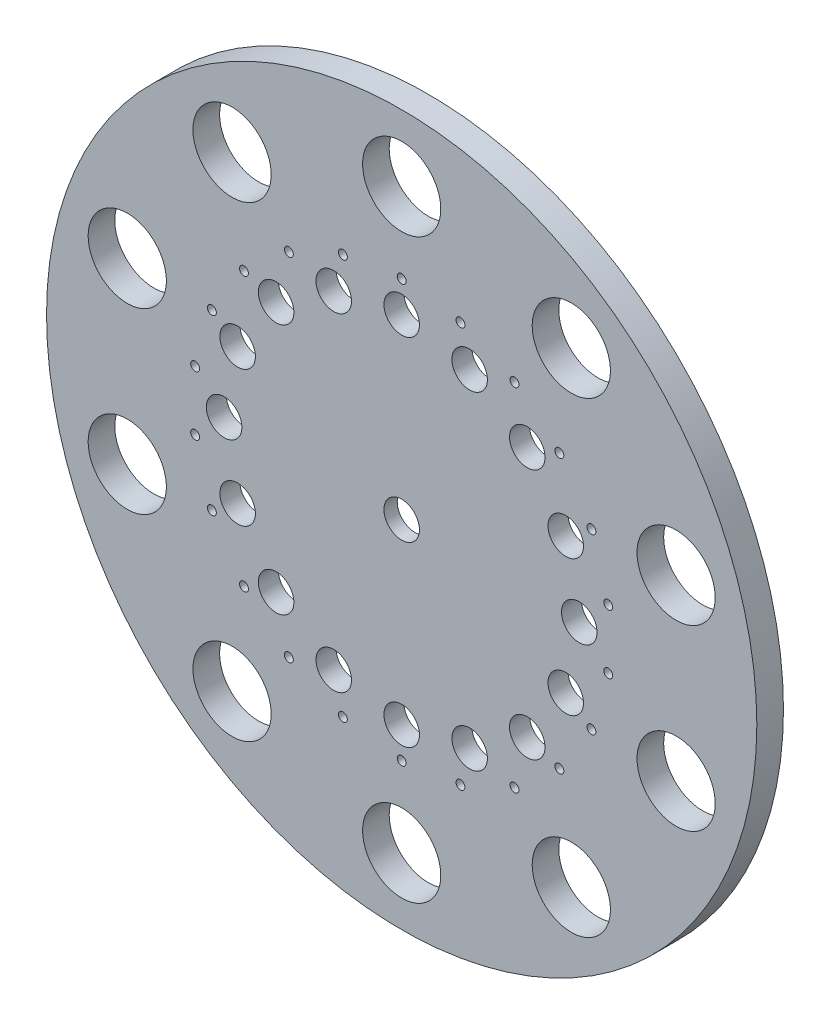
from build123d import *

# Parameters (mm, degrees)
SKETCH1_R           = 80
BOSS_EXTRUDE1_DEPTH = 6
SKETCH2_R           = 20
CUT_EXTRUDE1_DEPTH  = 3
SKETCH3_R           = 8.810326898
CUT_EXTRUDE3_DEPTH  = 6
SKETCH5_R           = 50
CUT_EXTRUDE5_DEPTH  = 1.5
SKETCH6_R           = 1
SKETCH6_R_2         = 4
CUT_EXTRUDE6_DEPTH  = 6
SKETCH7_R           = 4
CUT_EXTRUDE8_DEPTH  = 6


with BuildPart() as part:
    # Sketch1 → Boss-Extrude1 (new body)
    with BuildSketch(Plane.XY):
        Circle(SKETCH1_R)
    extrude(amount=BOSS_EXTRUDE1_DEPTH)

    # Sketch2 → Cut-Extrude1 (cut)
    with BuildSketch(Plane(origin=(0, 0, 0), x_dir=(-1, 0, 0), z_dir=(0, 0, -1))):
        Circle(SKETCH2_R)
    extrude(amount=-CUT_EXTRUDE1_DEPTH, mode=Mode.SUBTRACT)

    # Sketch3 → Cut-Extrude3 (cut)
    with BuildSketch(Plane(origin=(0, 0, 0), x_dir=(-1, 0, 0), z_dir=(0, 0, -1))):
        with Locations((0, 65)):
            Circle(SKETCH3_R)
        with Locations((38.206041399, 52.586104634)):
            Circle(SKETCH3_R)
        with Locations((61.818673559, 20.086104634)):
            Circle(SKETCH3_R)
        with Locations((61.818673559, -20.086104634)):
            Circle(SKETCH3_R)
        with Locations((38.206041399, -52.586104634)):
            Circle(SKETCH3_R)
        with Locations((0, -65)):
            Circle(SKETCH3_R)
        with Locations((-38.206041399, -52.586104634)):
            Circle(SKETCH3_R)
        with Locations((-61.818673559, -20.086104634)):
            Circle(SKETCH3_R)
        with Locations((-61.818673559, 20.086104634)):
            Circle(SKETCH3_R)
        with Locations((-38.206041399, 52.586104634)):
            Circle(SKETCH3_R)
    extrude(amount=-CUT_EXTRUDE3_DEPTH, mode=Mode.SUBTRACT)

    # Sketch5 → Cut-Extrude5 (cut)
    with BuildSketch(Plane(origin=(0, 0, 0), x_dir=(-1, 0, 0), z_dir=(0, 0, -1))):
        Circle(SKETCH5_R)
    extrude(amount=-CUT_EXTRUDE5_DEPTH, mode=Mode.SUBTRACT)

    # Sketch6 → Cut-Extrude6 (cut)
    with BuildSketch(Plane(origin=(0, 0, 1.5), x_dir=(-1, 0, 0), z_dir=(0, 0, -1))):
        with Locations((0, 47)):
            Circle(SKETCH6_R)
        with Locations((13.241430172, 45.09616976)):
            Circle(SKETCH6_R)
        with Locations((25.41011842, 39.538916043)):
            Circle(SKETCH6_R)
        with Locations((35.520229995, 30.778454495)):
            Circle(SKETCH6_R)
        with Locations((42.752703782, 19.524505611)):
            Circle(SKETCH6_R)
        with Locations((46.521607768, 6.688797399)):
            Circle(SKETCH6_R)
        with Locations((46.521607768, -6.688797399)):
            Circle(SKETCH6_R)
        with Locations((42.752703782, -19.524505611)):
            Circle(SKETCH6_R)
        with Locations((35.520229995, -30.778454495)):
            Circle(SKETCH6_R)
        with Locations((25.41011842, -39.538916043)):
            Circle(SKETCH6_R)
        with Locations((13.241430172, -45.09616976)):
            Circle(SKETCH6_R)
        with Locations((0, -47)):
            Circle(SKETCH6_R)
        with Locations((-13.241430172, -45.09616976)):
            Circle(SKETCH6_R)
        with Locations((-25.41011842, -39.538916043)):
            Circle(SKETCH6_R)
        with Locations((-35.520229995, -30.778454495)):
            Circle(SKETCH6_R)
        with Locations((-42.752703782, -19.524505611)):
            Circle(SKETCH6_R)
        with Locations((-46.521607768, -6.688797399)):
            Circle(SKETCH6_R)
        with Locations((-46.521607768, 6.688797399)):
            Circle(SKETCH6_R)
        with Locations((-42.752703782, 19.524505611)):
            Circle(SKETCH6_R)
        with Locations((-35.520229995, 30.778454495)):
            Circle(SKETCH6_R)
        with Locations((-25.41011842, 39.538916043)):
            Circle(SKETCH6_R)
        with Locations((-13.241430172, 45.09616976)):
            Circle(SKETCH6_R)
        with Locations((0, 40)):
            Circle(SKETCH6_R_2)
        with Locations((15.307337295, 36.9551813)):
            Circle(SKETCH6_R_2)
        with Locations((28.284271247, 28.284271247)):
            Circle(SKETCH6_R_2)
        with Locations((36.9551813, 15.307337295)):
            Circle(SKETCH6_R_2)
        with Locations((40, 0)):
            Circle(SKETCH6_R_2)
        with Locations((36.9551813, -15.307337295)):
            Circle(SKETCH6_R_2)
        with Locations((28.284271247, -28.284271247)):
            Circle(SKETCH6_R_2)
        with Locations((15.307337295, -36.9551813)):
            Circle(SKETCH6_R_2)
        with Locations((0, -40)):
            Circle(SKETCH6_R_2)
        with Locations((-15.307337295, -36.9551813)):
            Circle(SKETCH6_R_2)
        with Locations((-28.284271247, -28.284271247)):
            Circle(SKETCH6_R_2)
        with Locations((-36.9551813, -15.307337295)):
            Circle(SKETCH6_R_2)
        with Locations((-40, 0)):
            Circle(SKETCH6_R_2)
        with Locations((-36.9551813, 15.307337295)):
            Circle(SKETCH6_R_2)
        with Locations((-28.284271247, 28.284271247)):
            Circle(SKETCH6_R_2)
        with Locations((-15.307337295, 36.9551813)):
            Circle(SKETCH6_R_2)
    extrude(amount=-CUT_EXTRUDE6_DEPTH, mode=Mode.SUBTRACT)

    # Sketch7 → Cut-Extrude8 (cut)
    with BuildSketch(Plane(origin=(0, 0, 3), x_dir=(-1, 0, 0), z_dir=(0, 0, -1))):
        Circle(SKETCH7_R)
    extrude(amount=-CUT_EXTRUDE8_DEPTH, mode=Mode.SUBTRACT)


solid = part.part
